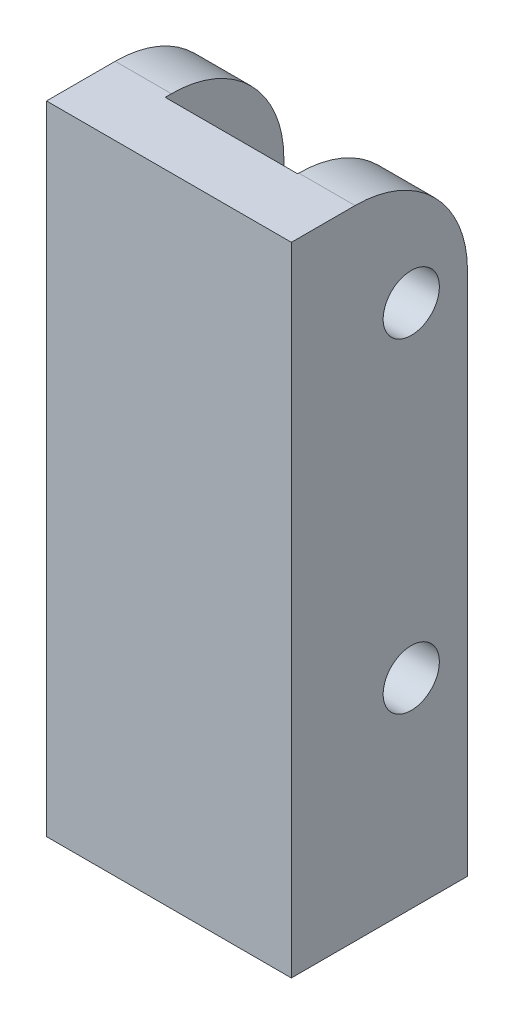
from build123d import *

# Parameters (mm, degrees)
EXTRUDE_1_DEPTH     = 51
SKETCH_2_R          = 2.25
CUT_EXTRUDE_1_DEPTH = 56.456379254
FILLET_1_R          = 9


with BuildPart() as part:
    # Эскиз1 → Бобышка-Вытянуть1 (new body)
    with BuildSketch(Plane(origin=(0, 0, 0), x_dir=(1, 0, 0), z_dir=(0, 1, 0))):
        Polygon((0, 0), (10.6, 0), (10.6, 9.097791798), (15.1, 9.097791798), (15.1, -5), (-4.5, -5), (-4.5, 9.5), (0, 9.5), align=None)
    extrude(amount=EXTRUDE_1_DEPTH)

    # Эскиз2 → Вырез-Вытянуть1 (cut, through all)
    with BuildSketch(Plane(origin=(15.1, 0, 0), x_dir=(0, 0, -1), z_dir=(1, 0, 0))):
        with Locations((4.597791798, 42)):
            Circle(SKETCH_2_R)
        with Locations((4.597791798, 16)):
            Circle(SKETCH_2_R)
    extrude(amount=-CUT_EXTRUDE_1_DEPTH, mode=Mode.SUBTRACT)

    # Скругление1
    fillet_1_edges = [part.edges().sort_by_distance(p)[0] for p in [
        (12.85, 51, -9.097791798),
        (-2.25, 51, -9.5),
    ]]
    fillet(fillet_1_edges, radius=FILLET_1_R)


solid = part.part
